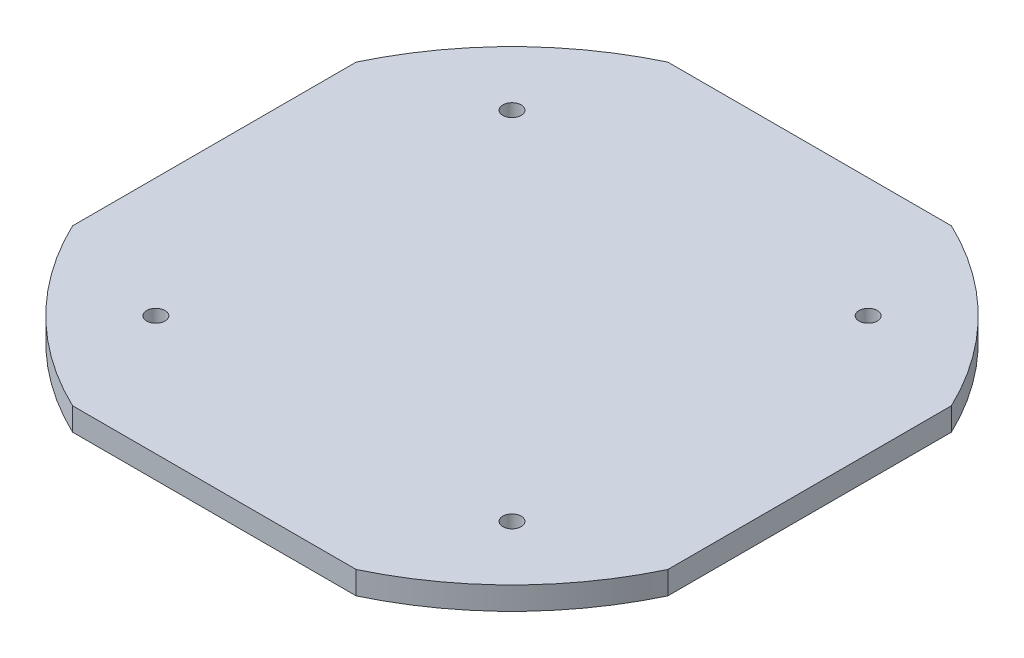
from build123d import *

# Parameters (mm, degrees)
BOSS_EXTRUDE1_DEPTH   = 5
F_4_0MM_DOWEL_HOLE2_D = 4


with BuildPart() as part:
    # Sketch1 → Boss-Extrude1 (new body)
    with BuildSketch(Plane(origin=(0, 0, 0), x_dir=(1, 0, 0), z_dir=(0, 1, 0))):
        with BuildLine():
            Line((65, 30.967725134), (65, -30.967725134))
            ThreePointArc((65, -30.967725134), (50.911688245, -50.911688245), (30.967725134, -65))
            Line((30.967725134, -65), (-30.967725134, -65))
            ThreePointArc((-30.967725134, -65), (-50.911688245, -50.911688245), (-65, -30.967725134))
            Line((-65, -30.967725134), (-65, 30.967725134))
            ThreePointArc((-65, 30.967725134), (-50.911688245, 50.911688245), (-30.967725134, 65))
            Line((-30.967725134, 65), (30.967725134, 65))
            ThreePointArc((30.967725134, 65), (50.911688245, 50.911688245), (65, 30.967725134))
        make_face()
    extrude(amount=BOSS_EXTRUDE1_DEPTH)

    # Ø4.0mm Dowel Hole2 (through all)
    with Locations(Plane(origin=(0, 5, 0), x_dir=(1, 0, 0), z_dir=(0, 1, 0))):
        with Locations((38.890872965, 38.890872965), (38.890872965, -38.890872965), (-38.890872965, -38.890872965), (-38.890872965, 38.890872965)):
            Hole(F_4_0MM_DOWEL_HOLE2_D / 2)


solid = part.part
